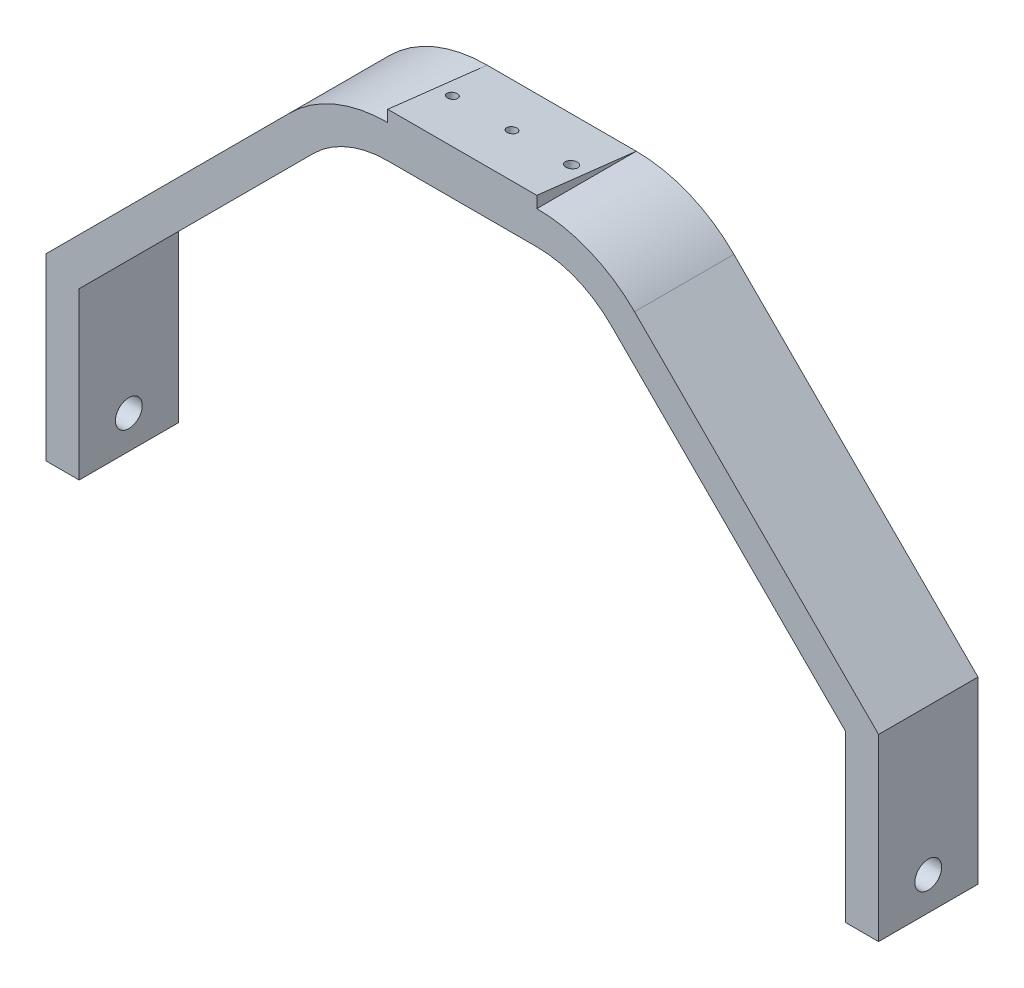
from build123d import *

# Parameters (mm, degrees)
SALIENTE_EXTRUIR1_DEPTH = 30
CROQUIS3_R              = 4.05
CORTAR_EXTRUIR1_DEPTH   = 287.780312831
CROQUIS4_R              = 1.5
CORTAR_EXTRUIR2_DEPTH   = 191.467453482
CROQUIS5_W              = 45
CROQUIS5_H              = 30
SALIENTE_EXTRUIR2_DEPTH = 12
CORTAR_EXTRUIR3_DEPTH   = 203.637632672
SALIENTE_EXTRUIR3_START = -13.471119
CROQUIS8_R              = 1.5
SALIENTE_EXTRUIR3_DEPTH = 13.471119
CROQUIS9_W              = 45
CROQUIS9_H              = 30.20014343
CORTAR_EXTRUIR5_DEPTH   = 10
CROQUIS10_R             = 1.5
CROQUIS10_R_2           = 1.735
CORTAR_EXTRUIR6_DEPTH   = 18


with BuildPart() as part:
    # Croquis1 → Saliente-Extruir1 (new body)
    with BuildSketch(Plane.XY):
        with BuildLine():
            Line((-22.5, -5), (22.5, -5))
            ThreePointArc((22.5, -5), (34.627023925, -7.412215038), (44.90781839, -14.28162228))
            Line((44.90781839, -14.28162228), (115.618496509, -84.992300399))
            Line((115.618496509, -84.992300399), (115.618496509, -134.992300399))
            Line((115.618496509, -134.992300399), (125.618496509, -134.992300399))
            Line((125.618496509, -134.992300399), (125.618496509, -80.850164775))
            Line((125.618496509, -80.850164775), (122.689564321, -77.921232587))
            Line((122.689564321, -77.921232587), (51.978886202, -7.210554468))
            ThreePointArc((51.978886202, -7.210554468), (38.453858249, 1.826580287), (22.5, 5))
            Line((22.5, 5), (-22.5, 5))
            ThreePointArc((-22.5, 5), (-38.453858249, 1.826580287), (-51.978886202, -7.210554468))
            Line((-51.978886202, -7.210554468), (-122.689564321, -77.921232587))
            Line((-122.689564321, -77.921232587), (-125.618496509, -80.850164775))
            Line((-125.618496509, -80.850164775), (-125.618496509, -134.992300399))
            Line((-125.618496509, -134.992300399), (-115.618496509, -134.992300399))
            Line((-115.618496509, -134.992300399), (-115.618496509, -84.992300399))
            Line((-115.618496509, -84.992300399), (-44.90781839, -14.28162228))
            ThreePointArc((-44.90781839, -14.28162228), (-34.627023925, -7.412215038), (-22.5, -5))
        make_face()
    extrude(amount=SALIENTE_EXTRUIR1_DEPTH)

    # Croquis3 → Cortar-Extruir1 (cut, through all)
    with BuildSketch(Plane.ZY.offset(125.618496509)):
        with Locations((15, -124.992300399)):
            Circle(CROQUIS3_R)
    extrude(amount=-CORTAR_EXTRUIR1_DEPTH, mode=Mode.SUBTRACT)

    # Croquis4 → Cortar-Extruir2 (cut, through all)
    with BuildSketch(Plane(origin=(0, 5, 0), x_dir=(1, 0, 0), z_dir=(0, 1, 0))):
        with Locations(Location((0, -15, 0), (0, 0, 270))):
            Circle(CROQUIS4_R)
        with Locations(Location((18, -15, 0), (0, 0, 270))):
            Circle(CROQUIS4_R)
        with Locations(Location((-18, -15, 0), (0, 0, 270))):
            Circle(CROQUIS4_R)
    extrude(amount=-CORTAR_EXTRUIR2_DEPTH, mode=Mode.SUBTRACT)

    # Croquis5 → Saliente-Extruir2 (add)
    with BuildSketch(Plane(origin=(0, 5, 0), x_dir=(1, 0, 0), z_dir=(0, 1, 0))):
        with Locations((0, -15)):
            Rectangle(CROQUIS5_W, CROQUIS5_H)
    extrude(amount=SALIENTE_EXTRUIR2_DEPTH)

    # Croquis6 → Cortar-Extruir3 (cut, through all)
    with BuildSketch(Plane(origin=(22.5, 0, 0), x_dir=(0, 0, -1), z_dir=(1, 0, 0))):
        Polygon((0, 5), (-30, 8.47111843), (-30, 19.923097654), (0, 19.923097654), align=None)
    extrude(amount=-CORTAR_EXTRUIR3_DEPTH, mode=Mode.SUBTRACT)

    # Croquis8 → Saliente-Extruir3 (add)
    with BuildSketch(Plane.XZ.offset(5).offset(SALIENTE_EXTRUIR3_START)):
        with Locations(Location((0, 15, 0), (0, 0, 270))):
            Circle(CROQUIS8_R)
        with Locations(Location((-18, 15, 0), (0, 0, 270))):
            Circle(CROQUIS8_R)
        with Locations(Location((18, 15, 0), (0, 0, 270))):
            Circle(CROQUIS8_R)
    extrude(amount=SALIENTE_EXTRUIR3_DEPTH)

    # Croquis9 → Cortar-Extruir5 (cut)
    with BuildSketch(Plane(origin=(0, 4.933947257, -0.570877175), x_dir=(1, 0, 0), z_dir=(0, 0.9933727656003972, -0.11493715049285988))):
        with Locations((0, -15.674757467)):
            Rectangle(CROQUIS9_W, CROQUIS9_H)
    extrude(amount=CORTAR_EXTRUIR5_DEPTH, mode=Mode.SUBTRACT)

    # Croquis10 → Cortar-Extruir6 (cut)
    with BuildSketch(Plane(origin=(0, 4.933947257, -0.570877175), x_dir=(1, 0, 0), z_dir=(0, 0.9933727656003972, -0.11493715049285988))):
        with Locations(Location((0, -15.674757467, 0), (0, 0, 270))):
            Circle(CROQUIS10_R)
        with Locations(Location((-18, -15.674757467, 0), (0, 0, 270))):
            Circle(CROQUIS10_R)
        with Locations(Location((18, -15.674757467, 0), (0, 0, 270))):
            Circle(CROQUIS10_R_2)
    extrude(amount=-CORTAR_EXTRUIR6_DEPTH, mode=Mode.SUBTRACT)


solid = part.part
